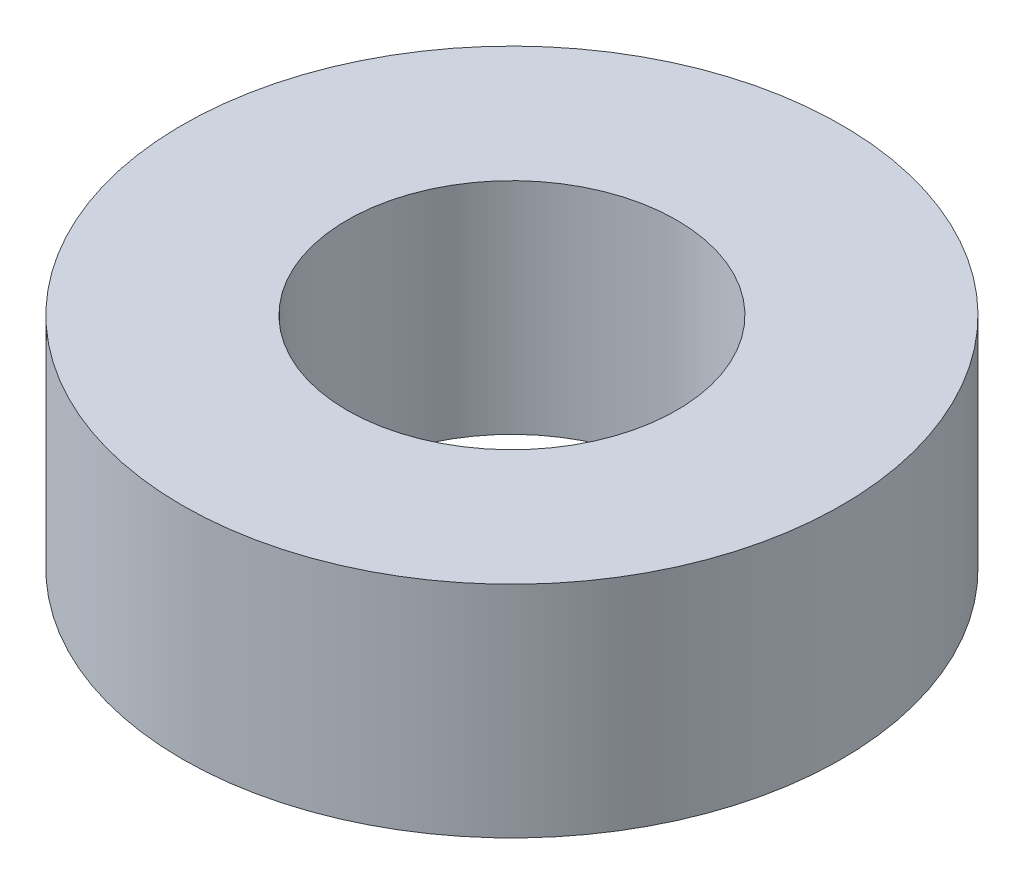
from build123d import *

# Parameters (mm, degrees)
SKETCH1_R           = 4.7625
SKETCH1_R_2         = 2.38125
BOSS_EXTRUDE1_DEPTH = 3.175


with BuildPart() as part:
    # Sketch1 → Boss-Extrude1 (new body)
    with BuildSketch(Plane(origin=(0, 0, 0), x_dir=(1, 0, 0), z_dir=(0, 1, 0))):
        with Locations(Location((0, 0, 0), (0, 0, 270))):
            Circle(SKETCH1_R)
        with Locations(Location((0, 0, 0), (0, 0, 270))):
            Circle(SKETCH1_R_2, mode=Mode.SUBTRACT)
    extrude(amount=BOSS_EXTRUDE1_DEPTH)


solid = part.part
